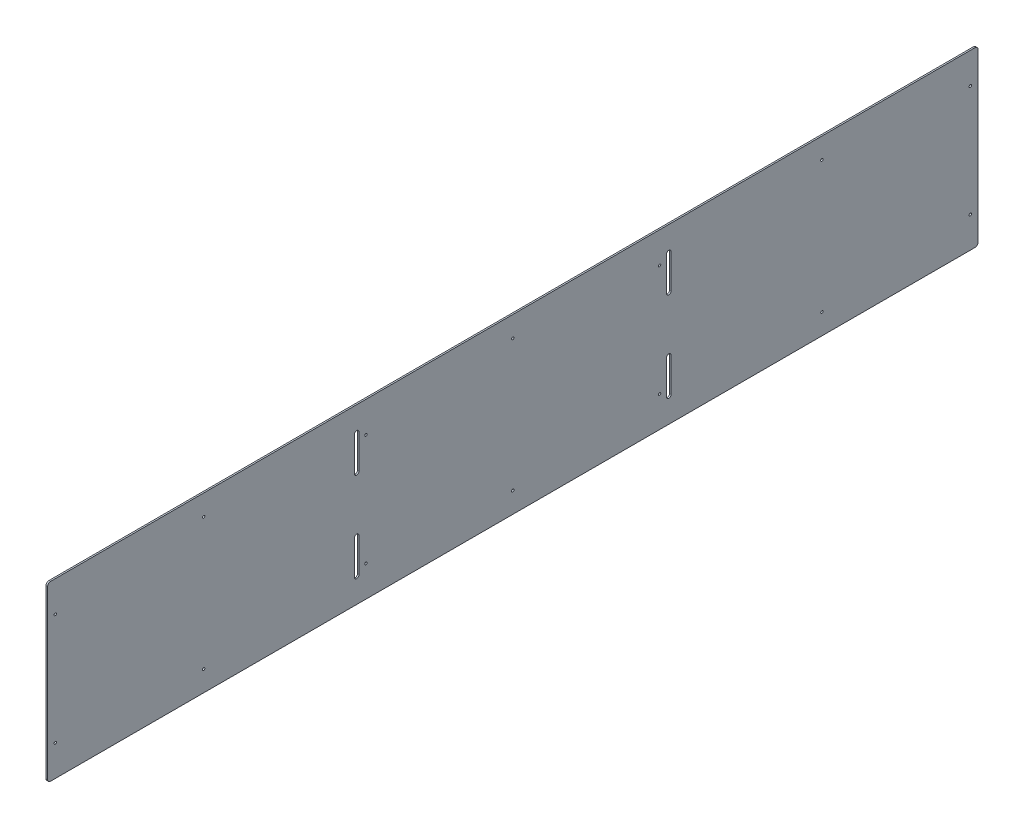
from build123d import *

# Parameters (mm, degrees)
SKETCH1_W           = 1911.35
SKETCH1_H           = 355.6
BOSS_EXTRUDE1_DEPTH = 3.175
SKETCH2_R           = 2.4511
CUT_EXTRUDE1_DEPTH  = 1945.15026763
FILLET1_R           = 6.35
CUT_EXTRUDE2_DEPTH  = 1945.15026763


with BuildPart() as part:
    # Sketch1 → Boss-Extrude1 (new body)
    with BuildSketch(Plane(origin=(0, 0, 0), x_dir=(0, 0, -1), z_dir=(1, 0, 0))):
        with Locations((955.675, 177.8)):
            Rectangle(SKETCH1_W, SKETCH1_H)
    extrude(amount=BOSS_EXTRUDE1_DEPTH)

    # Sketch2 → Cut-Extrude1 (cut, through all)
    with BuildSketch(Plane(origin=(3.175, 0, 0), x_dir=(0, 0, -1), z_dir=(1, 0, 0))):
        with Locations((15.875, 292.1)):
            Circle(SKETCH2_R)
        with Locations((654.05, 292.1)):
            Circle(SKETCH2_R)
        with Locations((320.675, 313.182)):
            Circle(SKETCH2_R)
        with Locations((955.675, 313.182)):
            Circle(SKETCH2_R)
        with Locations((1590.675, 313.182)):
            Circle(SKETCH2_R)
        with Locations((955.675, 42.418)):
            Circle(SKETCH2_R)
        with Locations((1590.675, 42.418)):
            Circle(SKETCH2_R)
        with Locations((320.675, 42.418)):
            Circle(SKETCH2_R)
        with Locations((15.875, 63.5)):
            Circle(SKETCH2_R)
        with Locations((654.05, 63.5)):
            Circle(SKETCH2_R)
        with Locations(Location((1895.475, 63.5, 0), (0, 0, 180))):
            Circle(SKETCH2_R)
        with Locations(Location((1895.475, 292.1, 0), (0, 0, 180))):
            Circle(SKETCH2_R)
        with Locations(Location((1257.3, 63.5, 0), (0, 0, 180))):
            Circle(SKETCH2_R)
        with Locations(Location((1257.3, 292.1, 0), (0, 0, 180))):
            Circle(SKETCH2_R)
    extrude(amount=-CUT_EXTRUDE1_DEPTH, mode=Mode.SUBTRACT)

    # Fillet1
    fillet1_edges = [part.edges().sort_by_distance(p)[0] for p in [
        (1.5875, 355.6, 0),
        (1.5875, 355.6, -1911.35),
        (1.5875, 0, -1911.35),
        (1.5875, 0, 0),
    ]]
    fillet(fillet1_edges, radius=FILLET1_R)

    # Sketch3 → Cut-Extrude2 (cut, through all)
    with BuildSketch(Plane(origin=(3.175, 0, 0), x_dir=(0, 0, -1), z_dir=(1, 0, 0))):
        with BuildLine():
            Line((639.7625, 304.8), (639.7625, 234.95))
            ThreePointArc((639.7625, 234.95), (635, 230.1875), (630.2375, 234.95))
            Line((630.2375, 234.95), (630.2375, 304.8))
            ThreePointArc((630.2375, 304.8), (635, 309.5625), (639.7625, 304.8))
        make_face()
        with BuildLine():
            Line((1281.1125, 304.8), (1281.1125, 234.95))
            ThreePointArc((1281.1125, 234.95), (1276.35, 230.1875), (1271.5875, 234.95))
            Line((1271.5875, 234.95), (1271.5875, 304.8))
            ThreePointArc((1271.5875, 304.8), (1276.35, 309.5625), (1281.1125, 304.8))
        make_face()
        with BuildLine():
            Line((1281.1125, 50.8), (1281.1125, 120.65))
            ThreePointArc((1281.1125, 120.65), (1276.35, 125.4125), (1271.5875, 120.65))
            Line((1271.5875, 120.65), (1271.5875, 50.8))
            ThreePointArc((1271.5875, 50.8), (1276.35, 46.0375), (1281.1125, 50.8))
        make_face()
        with BuildLine():
            Line((639.7625, 50.8), (639.7625, 120.65))
            ThreePointArc((639.7625, 120.65), (635, 125.4125), (630.2375, 120.65))
            Line((630.2375, 120.65), (630.2375, 50.8))
            ThreePointArc((630.2375, 50.8), (635, 46.0375), (639.7625, 50.8))
        make_face()
    extrude(amount=-CUT_EXTRUDE2_DEPTH, mode=Mode.SUBTRACT)


solid = part.part
